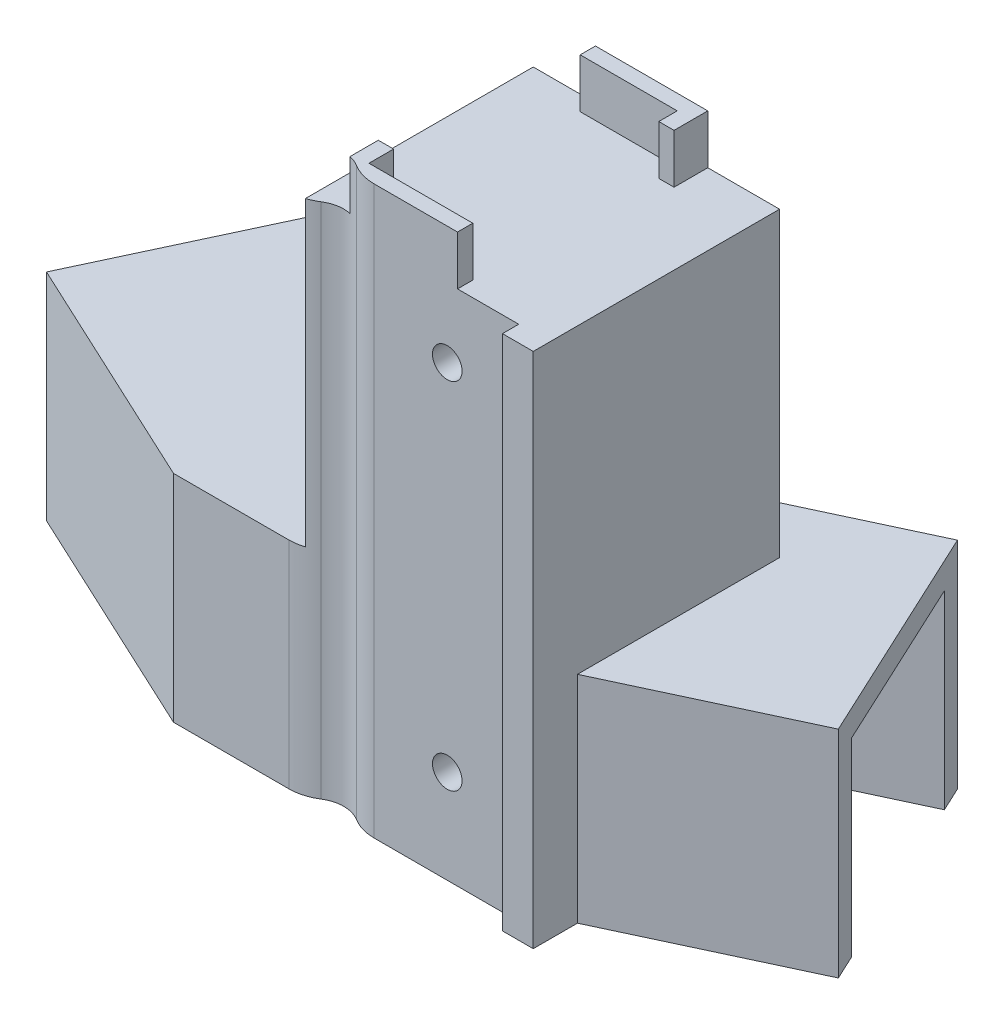
from build123d import *

# Parameters (mm, degrees)
BOSS_EXTRUDE1_DEPTH        = 22.225
SKETCH2_W                  = 19.812
SKETCH2_H                  = 19.558
CUT_EXTRUDE1_DEPTH         = 25.4
BOSS_EXTRUDE3_DEPTH        = 22.225
CUT_EXTRUDE2_DEPTH         = 53.968700624
BOSS_EXTRUDE4_DEPTH        = 31.115
F_6_CLEARANCE_HOLE1_REACH  = 77.492
F_6_CLEARANCE_HOLE1_BORE_R = 1.524
SKETCH13_W                 = 1.5748
SKETCH13_H                 = 1.905
BOSS_EXTRUDE5_DEPTH        = 5.08


with BuildPart() as part:
    # Sketch1 → Boss-Extrude1 (new body)
    with BuildSketch(Plane(origin=(0, 0, 0), x_dir=(1, 0, 0), z_dir=(0, 1, 0))):
        Polygon((30.08917336, 10.734503848), (40.823677208, -12.285713943), (12.7, -25.4), (0, -25.4), (0, 0), (7.068955569, 0), align=None)
    boss_extrude1 = extrude(amount=BOSS_EXTRUDE1_DEPTH)

    # Sketch2 → Cut-Extrude1 (cut)
    with BuildSketch(Plane(origin=(28.826614102, 0, -13.442070914), x_dir=(-0.4226182617407009, 0, -0.9063077870366494), z_dir=(0.9063077870366494, 0, -0.4226182617407009))):
        with Locations((-15.687469715, 9.779)):
            Rectangle(SKETCH2_W, SKETCH2_H)
    cut_extrude1 = extrude(amount=-CUT_EXTRUDE1_DEPTH, mode=Mode.SUBTRACT)

    # Mirror1: Boss-Extrude1, Cut-Extrude1 across plane
    add(boss_extrude1.mirror(Plane(origin=(0, 22.225, 0), x_dir=(0, 0, 1), z_dir=(1, 0, 0))))
    add(cut_extrude1.mirror(Plane(origin=(0, 22.225, 0), x_dir=(0, 0, 1), z_dir=(1, 0, 0))), mode=Mode.SUBTRACT)

    # Sketch4 → Boss-Extrude3 (add)
    with BuildSketch(Plane(origin=(0, 22.225, 0), x_dir=(1, 0, 0), z_dir=(0, 1, 0))):
        Polygon((22.479000043, -20.839977391), (12.7, -25.4), (22.479000043, -25.4), align=None)
    extrude(amount=-BOSS_EXTRUDE3_DEPTH)

    # Sketch6 → Cut-Extrude2 (cut, through all)
    with BuildSketch(Plane.XZ):
        with BuildLine():
            Line((19.304000043, 23.7236), (4.399409051, 23.7236))
            ThreePointArc((4.399409051, 23.7236), (3.060917478, 23.534270822), (1.827446837, 22.981138462))
            ThreePointArc((1.827446837, 22.981138462), (-1.441154453, 22.771151006), (-3.3948694, 25.4))
            Line((-3.3948694, 25.4), (19.304000043, 25.4))
            Line((19.304000043, 25.4), (19.304000043, 23.7236))
        make_face()
    cut_extrude2 = extrude(amount=-CUT_EXTRUDE2_DEPTH, mode=Mode.SUBTRACT)

    # Sketch11 → Boss-Extrude4 (add)
    with BuildSketch(Plane(origin=(0, 22.225, 0), x_dir=(1, 0, 0), z_dir=(0, 1, 0))):
        with BuildLine():
            Line((22.479000043, -25.4), (22.479000043, -20.839977391))
            Line((22.479000043, -20.839977391), (22.479000043, 0))
            Line((22.479000043, 0), (7.068955569, 0))
            Line((7.068955569, 0), (-2.920999957, 0))
            Line((-2.920999957, 0), (-2.920999957, -24.086548706))
            ThreePointArc((-2.920999957, -24.086548706), (-0.777462256, -22.542900397), (1.827446837, -22.981138462))
            ThreePointArc((1.827446837, -22.981138462), (3.060917478, -23.534270822), (4.399409051, -23.7236))
            Line((4.399409051, -23.7236), (19.304000043, -23.7236))
            Line((19.304000043, -23.7236), (19.304000043, -25.4))
            Line((19.304000043, -25.4), (22.479000043, -25.4))
        make_face()
    extrude(amount=BOSS_EXTRUDE4_DEPTH)

    # #6 Clearance Hole1 bore → #6 Clearance Hole1 (cut, up to next)
    with BuildSketch(Plane.XY.offset(23.7236), mode=Mode.PRIVATE) as f_6_clearance_hole1_sk1:
        with Locations((11.938000043, 9.652)):
            Circle(F_6_CLEARANCE_HOLE1_BORE_R)
    f_6_clearance_hole1_tool1 = extrude(f_6_clearance_hole1_sk1.sketch, amount=-F_6_CLEARANCE_HOLE1_REACH, mode=Mode.PRIVATE) & part.part
    # #6 Clearance Hole1 bore → #6 Clearance Hole1 (cut, up to next)
    with BuildSketch(Plane.XY.offset(23.7236), mode=Mode.PRIVATE) as f_6_clearance_hole1_sk2:
        with Locations((11.938000043, 46.228)):
            Circle(F_6_CLEARANCE_HOLE1_BORE_R)
    f_6_clearance_hole1_tool2 = extrude(f_6_clearance_hole1_sk2.sketch, amount=-F_6_CLEARANCE_HOLE1_REACH, mode=Mode.PRIVATE) & part.part
    add(f_6_clearance_hole1_tool1.solids().sort_by_distance((11.938, 9.652, 23.7236))[0], mode=Mode.SUBTRACT)
    add(f_6_clearance_hole1_tool2.solids().sort_by_distance((11.938, 46.228, 23.7236))[0], mode=Mode.SUBTRACT)

    # Mirror2: Cut-Extrude2 across plane
    add(cut_extrude2.mirror(Plane(origin=(0, 0, 0), x_dir=(0, 0, 1), z_dir=(1, 0, 0))), mode=Mode.SUBTRACT)

    # Sketch13 → Boss-Extrude5 (add)
    with BuildSketch(Plane(origin=(0, 53.34, 0), x_dir=(1, 0, 0), z_dir=(0, 1, 0))):
        with BuildLine():
            Line((4.399409051, -23.7236), (12.994000043, -23.7236))
            Line((12.994000043, -23.7236), (12.994000043, -22.1488))
            Line((12.994000043, -22.1488), (2.286000043, -22.1488))
            Line((2.286000043, -22.1488), (2.286000043, -19.6088))
            Line((2.286000043, -19.6088), (0.711200043, -19.6088))
            Line((0.711200043, -19.6088), (0.711200043, -22.528164802))
            ThreePointArc((0.711200043, -22.528164802), (1.289371273, -22.705248474), (1.827446837, -22.981138462))
            ThreePointArc((1.827446837, -22.981138462), (3.060917478, -23.534270822), (4.399409051, -23.7236))
        make_face()
        Polygon((15.076800043, 0), (3.494000043, 0), (3.494000043, -1.5748), (13.502000043, -1.5748), (15.076800043, -1.5748), align=None)
        with Locations((14.289400043, -2.5273)):
            Rectangle(SKETCH13_W, SKETCH13_H)
    extrude(amount=BOSS_EXTRUDE5_DEPTH)


solid = part.part
